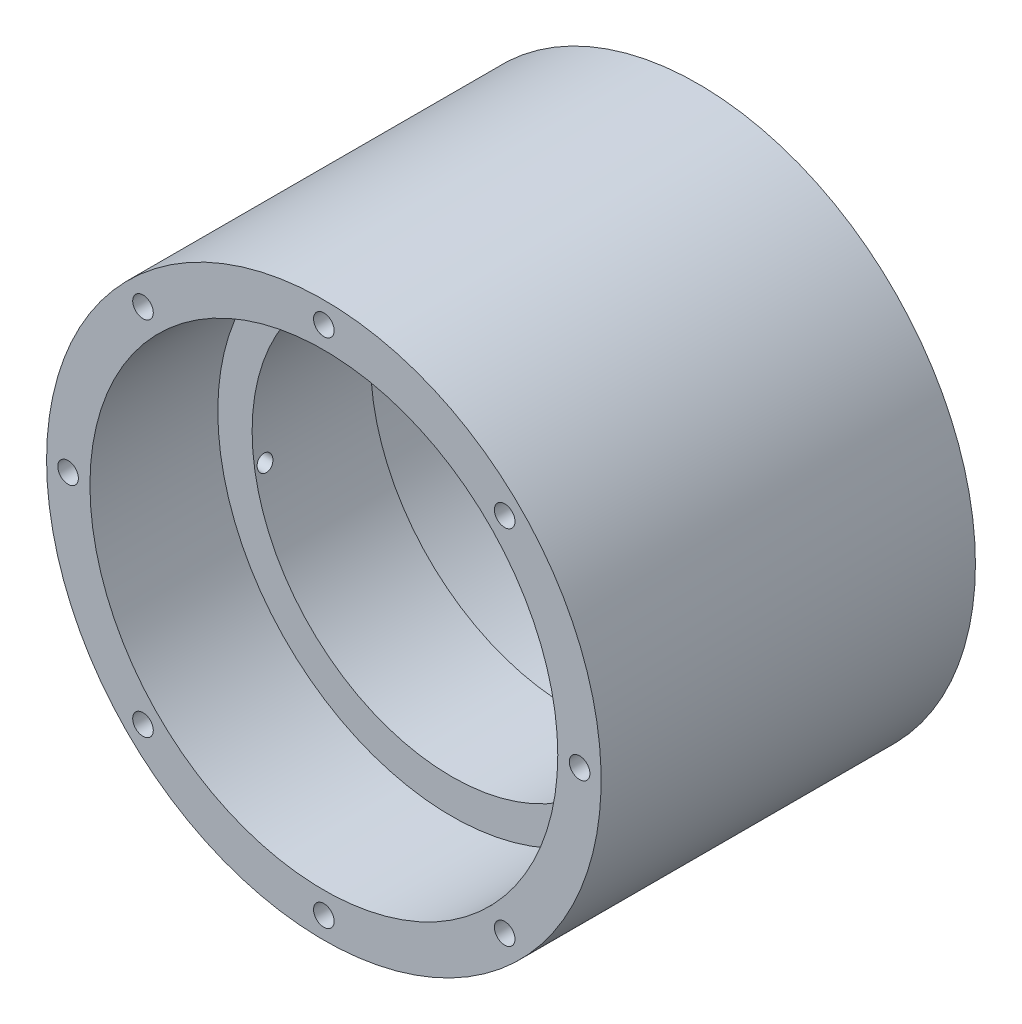
from build123d import *

# Parameters (mm, degrees)
SKETCH1_W                  = 44.45
SKETCH1_H                  = 60
CUT_EXTRUDE1_START         = -50
CUT_EXTRUDE1_DEPTH         = 50
F_4_CLEARANCE_HOLE1_D      = 3.3
F_4_CLEARANCE_HOLE1_DEPTH  = 8
F_2_CLEARANCE_HOLE1_REACH  = 117.544
F_2_CLEARANCE_HOLE1_BORE_R = 1.25
F_2_CLEARANCE_HOLE2_REACH  = 117.544
F_2_CLEARANCE_HOLE2_BORE_R = 1.25


with BuildPart() as part:
    # Sketch1 → Revolve1 (revolve)
    with BuildSketch(Plane.XZ, mode=Mode.PRIVATE) as revolve1_sk:
        with Locations((22.225, 30)):
            Rectangle(SKETCH1_W, SKETCH1_H)
    revolve(revolve1_sk.sketch.rotate(Axis((0, 0, 60), (0, 0, -1)), 180), axis=Axis((0, 0, 60), (0, 0, -1)))

    # Sketch2 → Cut-Extrude1 (cut)
    with BuildSketch(Plane(origin=(0, 0, 0), x_dir=(-1, 0, 0), z_dir=(0, 0, -1)).offset(CUT_EXTRUDE1_START)):
        with BuildLine():
            Line((43.7241638, 8), (43.7241638, -8))
            ThreePointArc((43.7241638, -8), (44.45, 0), (43.7241638, 8))
        make_face()
    extrude(amount=CUT_EXTRUDE1_DEPTH, mode=Mode.SUBTRACT)

    # Sketch3 → Cut-Revolve1 (revolve, cut)
    with BuildSketch(Plane.XZ, mode=Mode.PRIVATE) as cut_revolve1_sk:
        Polygon((37.5, 60), (0, 60), (0, 0), (37.5, 0), (37.5, 20.5), (32, 20.5), (32, 39.5), (37.5, 39.5), align=None)
    revolve(cut_revolve1_sk.sketch.rotate(Axis((0, 0, 60), (0, 0, -1)), 180), axis=Axis((0, 0, 60), (0, 0, -1)), mode=Mode.SUBTRACT)

    # #4 Clearance Hole1
    with Locations(Plane.XY.offset(60)):
        with Locations((28.991378029, 28.991378029), (0, 41), (-28.991378029, 28.991378029), (-41, 0), (-28.991378029, -28.991378029), (0, -41), (28.991378029, -28.991378029), (41, 0)):
            Hole(F_4_CLEARANCE_HOLE1_D / 2, depth=F_4_CLEARANCE_HOLE1_DEPTH)

    # #2 Clearance Hole1 bore → #2 Clearance Hole1 (cut, up to next)
    with BuildSketch(Plane.ZY.offset(43.7241638), mode=Mode.PRIVATE) as f_2_clearance_hole1_sk1:
        with Locations((15.584748033, 5.15)):
            Circle(F_2_CLEARANCE_HOLE1_BORE_R)
    f_2_clearance_hole1_tool1 = extrude(f_2_clearance_hole1_sk1.sketch, amount=-F_2_CLEARANCE_HOLE1_REACH, mode=Mode.PRIVATE) & part.part
    add(f_2_clearance_hole1_tool1.solids().sort_by_distance((-43.724164, 5.15, 15.584748))[0], mode=Mode.SUBTRACT)

    # #2 Clearance Hole2 bore → #2 Clearance Hole2 (cut, up to next)
    with BuildSketch(Plane.ZY.offset(43.7241638), mode=Mode.PRIVATE) as f_2_clearance_hole2_sk1:
        with Locations((37.834748033, -5.05)):
            Circle(F_2_CLEARANCE_HOLE2_BORE_R)
    f_2_clearance_hole2_tool1 = extrude(f_2_clearance_hole2_sk1.sketch, amount=-F_2_CLEARANCE_HOLE2_REACH, mode=Mode.PRIVATE) & part.part
    add(f_2_clearance_hole2_tool1.solids().sort_by_distance((-43.724164, -5.05, 37.834748))[0], mode=Mode.SUBTRACT)


solid = part.part
